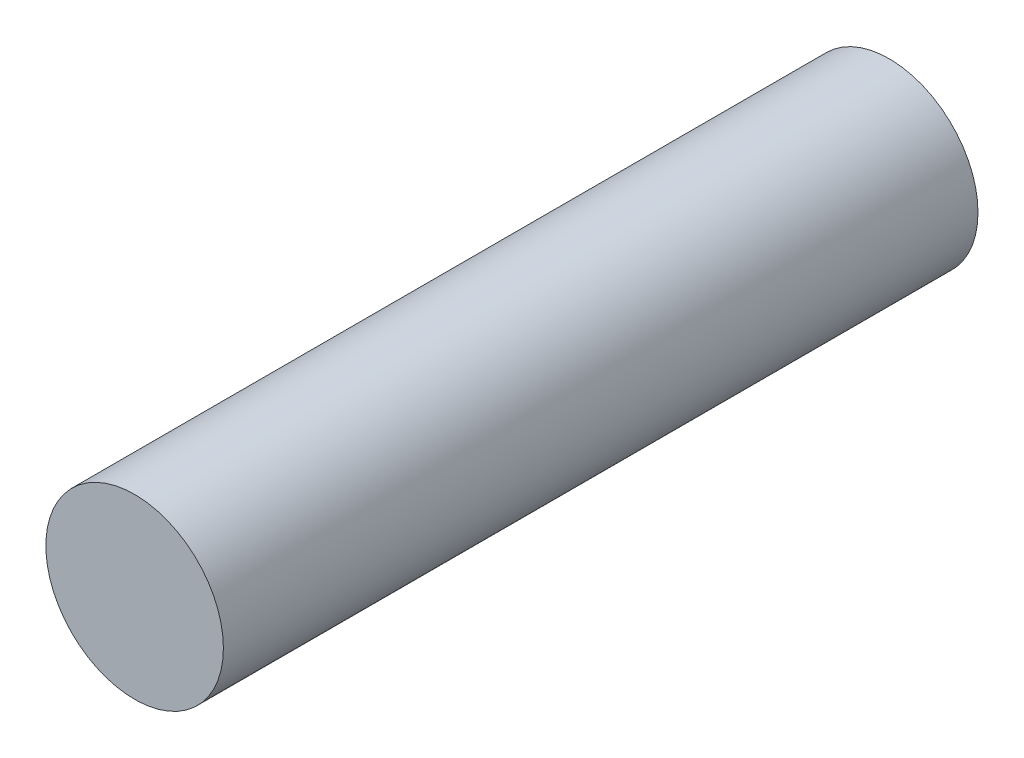
from build123d import *

# Parameters (mm, degrees)
SKETCH_1_R      = 1
EXTRUDE_1_DEPTH = 8.5


with BuildPart() as part:
    # Эскиз1 → Бобышка-Вытянуть1 (new body)
    with BuildSketch(Plane.XY):
        Circle(SKETCH_1_R)
    extrude(amount=EXTRUDE_1_DEPTH)


solid = part.part
